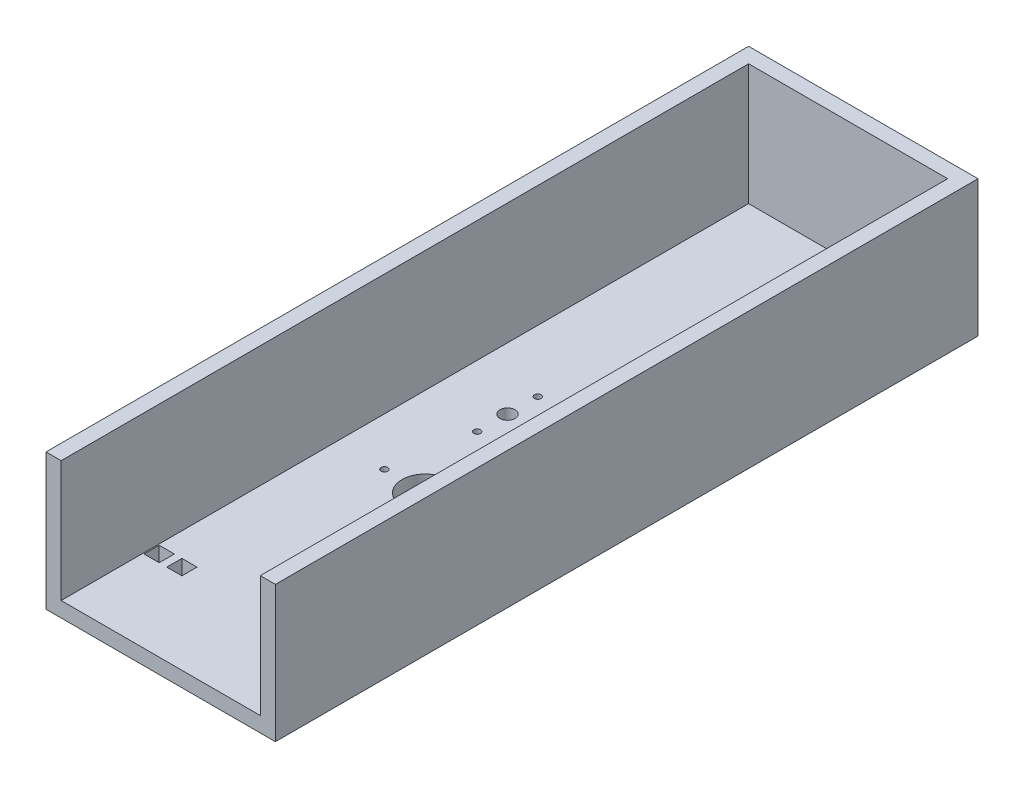
from build123d import *

# Parameters (mm, degrees)
BOSS_EXTRUDE1_DEPTH            = 294.64
SKETCH2_W                      = 83.5
SKETCH2_H                      = 6.35
BOSS_EXTRUDE2_DEPTH            = 50.8
SKETCH3_R                      = 2.38125
CUT_EXTRUDE1_DEPTH             = 6.35
CUT_EXTRUDE2_REACH             = 304.832
SKETCH4_R                      = 9.7282
SKETCH4_R_2                    = 1.3890625
CUT_EXTRUDE3_REACH             = 304.832
SKETCH5_R                      = 3.175
SKETCH5_R_2                    = 1.3890625
CUT_EXTRUDE3_DIRECTION_2_DEPTH = 303.83160271
SKETCH6_W                      = 6.35
SKETCH6_H                      = 6.35
CUT_EXTRUDE4_DEPTH             = 6.35


with BuildPart() as part:
    # Sketch1 → Boss-Extrude1 (new body)
    with BuildSketch(Plane.XY):
        Polygon((0, 0), (41.75, 0), (41.75, 22.225), (41.75, 50.8), (48.1, 50.8), (48.1, -6.35), (0, -6.35), align=None)
    extrude(amount=BOSS_EXTRUDE1_DEPTH)

    # Mirror1: part across plane


with BuildPart() as part_1:
    add(part.part)
    add(part.part.mirror(Plane(origin=(0, -6.35, 294.64), x_dir=(0, 0, 1), z_dir=(-1, 0, 0))))

    # Sketch2 → Boss-Extrude2 (add)
    with BuildSketch(Plane(origin=(0, 0, 0), x_dir=(1, 0, 0), z_dir=(0, 1, 0))):
        with Locations((0, -3.175)):
            Rectangle(SKETCH2_W, SKETCH2_H)
    extrude(amount=BOSS_EXTRUDE2_DEPTH)

    # Sketch3 → Cut-Extrude1 (cut)
    with BuildSketch(Plane.XZ.offset(6.35)):
        with Locations((0, 12.7)):
            Circle(SKETCH3_R)
        with Locations((0, 93.98)):
            Circle(SKETCH3_R)
    extrude(amount=-CUT_EXTRUDE1_DEPTH, mode=Mode.SUBTRACT)

    # Sketch4 → Cut-Extrude2 (cut, up to next)
    with BuildSketch(Plane(origin=(0, 0, 0), x_dir=(1, 0, 0), z_dir=(0, 1, 0)), mode=Mode.PRIVATE) as cut_extrude2_sk1:
        with Locations(Location((-4.490010202, -179.209178053, 0), (0, 0, 270))):
            Circle(SKETCH4_R)
    cut_extrude2_tool1 = extrude(cut_extrude2_sk1.sketch, amount=-CUT_EXTRUDE2_REACH, mode=Mode.PRIVATE) & part_1.part
    # Sketch4 → Cut-Extrude2 (cut, up to next)
    with BuildSketch(Plane(origin=(0, 0, 0), x_dir=(1, 0, 0), z_dir=(0, 1, 0)), mode=Mode.PRIVATE) as cut_extrude2_sk2:
        with Locations(Location((-21.635010202, -179.209178053, 0), (0, 0, 270))):
            Circle(SKETCH4_R_2)
    cut_extrude2_tool2 = extrude(cut_extrude2_sk2.sketch, amount=-CUT_EXTRUDE2_REACH, mode=Mode.PRIVATE) & part_1.part
    # Sketch4 → Cut-Extrude2 (cut, up to next)
    with BuildSketch(Plane(origin=(0, 0, 0), x_dir=(1, 0, 0), z_dir=(0, 1, 0)), mode=Mode.PRIVATE) as cut_extrude2_sk3:
        with Locations(Location((12.654989798, -179.209178053, 0), (0, 0, 270))):
            Circle(SKETCH4_R_2)
    cut_extrude2_tool3 = extrude(cut_extrude2_sk3.sketch, amount=-CUT_EXTRUDE2_REACH, mode=Mode.PRIVATE) & part_1.part
    add(cut_extrude2_tool1.solids().sort_by_distance((-4.49001, 0, 179.209178))[0], mode=Mode.SUBTRACT)
    add(cut_extrude2_tool2.solids().sort_by_distance((-21.63501, 0, 179.209178))[0], mode=Mode.SUBTRACT)
    add(cut_extrude2_tool3.solids().sort_by_distance((12.65499, 0, 179.209178))[0], mode=Mode.SUBTRACT)

    # Sketch5 → Cut-Extrude3 (cut, up to next)
    with BuildSketch(Plane(origin=(0, 0, 0), x_dir=(1, 0, 0), z_dir=(0, 1, 0)), mode=Mode.PRIVATE) as cut_extrude3_sk1:
        with Locations((15.8749986, -133.35)):
            Circle(SKETCH5_R)
    cut_extrude3_tool1 = extrude(cut_extrude3_sk1.sketch, amount=-CUT_EXTRUDE3_REACH, mode=Mode.PRIVATE) & part_1.part
    # Sketch5 → Cut-Extrude3 (cut, up to next)
    with BuildSketch(Plane(origin=(0, 0, 0), x_dir=(1, 0, 0), z_dir=(0, 1, 0)), mode=Mode.PRIVATE) as cut_extrude3_sk2:
        with Locations((-15.8749986, -133.35)):
            Circle(SKETCH5_R)
    cut_extrude3_tool2 = extrude(cut_extrude3_sk2.sketch, amount=-CUT_EXTRUDE3_REACH, mode=Mode.PRIVATE) & part_1.part
    # Sketch5 → Cut-Extrude3 (cut, up to next)
    with BuildSketch(Plane(origin=(0, 0, 0), x_dir=(1, 0, 0), z_dir=(0, 1, 0)), mode=Mode.PRIVATE) as cut_extrude3_sk3:
        with Locations((15.8749986, -146.05)):
            Circle(SKETCH5_R_2)
    cut_extrude3_tool3 = extrude(cut_extrude3_sk3.sketch, amount=-CUT_EXTRUDE3_REACH, mode=Mode.PRIVATE) & part_1.part
    # Sketch5 → Cut-Extrude3 (cut, up to next)
    with BuildSketch(Plane(origin=(0, 0, 0), x_dir=(1, 0, 0), z_dir=(0, 1, 0)), mode=Mode.PRIVATE) as cut_extrude3_sk4:
        with Locations((15.8749986, -120.65)):
            Circle(SKETCH5_R_2)
    cut_extrude3_tool4 = extrude(cut_extrude3_sk4.sketch, amount=-CUT_EXTRUDE3_REACH, mode=Mode.PRIVATE) & part_1.part
    # Sketch5 → Cut-Extrude3 (cut, up to next)
    with BuildSketch(Plane(origin=(0, 0, 0), x_dir=(1, 0, 0), z_dir=(0, 1, 0)), mode=Mode.PRIVATE) as cut_extrude3_sk5:
        with Locations((-15.8749986, -146.05)):
            Circle(SKETCH5_R_2)
    cut_extrude3_tool5 = extrude(cut_extrude3_sk5.sketch, amount=-CUT_EXTRUDE3_REACH, mode=Mode.PRIVATE) & part_1.part
    # Sketch5 → Cut-Extrude3 (cut, up to next)
    with BuildSketch(Plane(origin=(0, 0, 0), x_dir=(1, 0, 0), z_dir=(0, 1, 0)), mode=Mode.PRIVATE) as cut_extrude3_sk6:
        with Locations((-15.8749986, -120.65)):
            Circle(SKETCH5_R_2)
    cut_extrude3_tool6 = extrude(cut_extrude3_sk6.sketch, amount=-CUT_EXTRUDE3_REACH, mode=Mode.PRIVATE) & part_1.part
    add(cut_extrude3_tool1.solids().sort_by_distance((15.874999, 0, 133.35))[0], mode=Mode.SUBTRACT)
    add(cut_extrude3_tool2.solids().sort_by_distance((-15.874999, 0, 133.35))[0], mode=Mode.SUBTRACT)
    add(cut_extrude3_tool3.solids().sort_by_distance((15.874999, 0, 146.05))[0], mode=Mode.SUBTRACT)
    add(cut_extrude3_tool4.solids().sort_by_distance((15.874999, 0, 120.65))[0], mode=Mode.SUBTRACT)
    add(cut_extrude3_tool5.solids().sort_by_distance((-15.874999, 0, 146.05))[0], mode=Mode.SUBTRACT)
    add(cut_extrude3_tool6.solids().sort_by_distance((-15.874999, 0, 120.65))[0], mode=Mode.SUBTRACT)

    # Sketch5 → Cut-Extrude3 direction 2 (cut)
    with BuildSketch(Plane(origin=(0, 0, 0), x_dir=(1, 0, 0), z_dir=(0, 1, 0))):
        with Locations((15.8749986, -133.35)):
            Circle(SKETCH5_R)
        with Locations((-15.8749986, -133.35)):
            Circle(SKETCH5_R)
        with Locations((15.8749986, -146.05)):
            Circle(SKETCH5_R_2)
        with Locations((15.8749986, -120.65)):
            Circle(SKETCH5_R_2)
        with Locations((-15.8749986, -146.05)):
            Circle(SKETCH5_R_2)
        with Locations((-15.8749986, -120.65)):
            Circle(SKETCH5_R_2)
    extrude(amount=CUT_EXTRUDE3_DIRECTION_2_DEPTH, mode=Mode.SUBTRACT)

    # Sketch6 → Cut-Extrude4 (cut)
    with BuildSketch(Plane(origin=(0, 0, 0), x_dir=(1, 0, 0), z_dir=(0, 1, 0))):
        with Locations((28.575, -257.175)):
            Rectangle(SKETCH6_W, SKETCH6_H)
        with Locations((-28.575, -257.175)):
            Rectangle(SKETCH6_W, SKETCH6_H)
        with Locations((38.1, -257.175)):
            Rectangle(SKETCH6_W, SKETCH6_H)
        with Locations((-38.1, -257.175)):
            Rectangle(SKETCH6_W, SKETCH6_H)
    extrude(amount=-CUT_EXTRUDE4_DEPTH, mode=Mode.SUBTRACT)


solid = part_1.part
